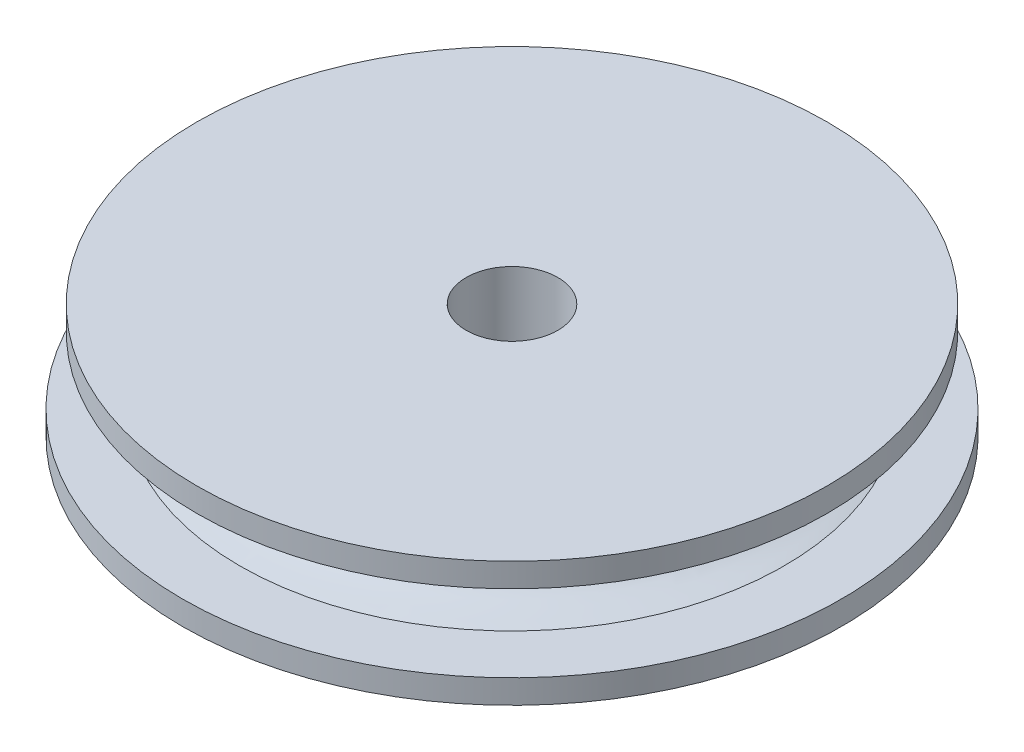
from build123d import *

# Parameters (mm, degrees)
SKETCH1_R           = 9.5
BOSS_EXTRUDE1_DEPTH = 4
SKETCH3_R           = 1.6
CUT_EXTRUDE1_DEPTH  = 15.017845904
SKETCH4_R           = 11
SKETCH4_R_2         = 1.6
EXTENSION_TOP_DEPTH = 0.832825
BOSS_EXTRUDE4_START = -0.832825
SKETCH5_R           = 11.5
SKETCH5_R_2         = 1.6
BOSS_EXTRUDE4_DEPTH = 0.832825


with BuildPart() as part:
    # Sketch1 → Boss-Extrude1 (new body)
    with BuildSketch(Plane(origin=(0, 0, 0), x_dir=(1, 0, 0), z_dir=(0, 1, 0))):
        with Locations(Location((0, 0, 0), (0, 0, 270))):
            Circle(SKETCH1_R)
    extrude(amount=BOSS_EXTRUDE1_DEPTH)

    # Sketch2 → Cut-Revolve3 (revolve, cut)
    with BuildSketch(Plane.XY, mode=Mode.PRIVATE) as cut_revolve3_sk:
        with BuildLine():
            Line((-9.5, 3.167174781), (-9.5, 0.832825219))
            add(Edge.make_bspline(
                [(-9.5, 0.832825219), (-8.911003923, 1.01519245), (-7.940181452, 1.15692307), (-8, 2)],
                knots=[0, 0, 0, 0, 1, 1, 1, 1], degree=3))
            add(Edge.make_bspline(
                [(-9.5, 3.167174781), (-8.911003923, 2.98480755), (-7.940181452, 2.84307693), (-8, 2)],
                knots=[0, 0, 0, 0, 1, 1, 1, 1], degree=3))
        make_face()
    revolve(cut_revolve3_sk.sketch.rotate(Axis((0, 4.2, 0), (0, -1, 0)), 270), axis=Axis((0, 4.2, 0), (0, -1, 0)), mode=Mode.SUBTRACT)

    # Sketch3 → Cut-Extrude1 (cut, through all)
    with BuildSketch(Plane(origin=(0, 4, 0), x_dir=(1, 0, 0), z_dir=(0, 1, 0))):
        with Locations(Location((0, 0, 0), (0, 0, 270))):
            Circle(SKETCH3_R)
    extrude(amount=-CUT_EXTRUDE1_DEPTH, mode=Mode.SUBTRACT)

    # Sketch4 → Extension top (add)
    with BuildSketch(Plane(origin=(0, 4, 0), x_dir=(1, 0, 0), z_dir=(0, 1, 0))):
        with Locations(Location((0, 0, 0), (0, 0, 270))):
            Circle(SKETCH4_R)
        with Locations(Location((0, 0, 0), (0, 0, 270))):
            Circle(SKETCH4_R_2, mode=Mode.SUBTRACT)
    extrude(amount=-EXTENSION_TOP_DEPTH)

    # Sketch5 → Boss-Extrude4 (add)
    with BuildSketch(Plane.XZ.offset(BOSS_EXTRUDE4_START)):
        with Locations(Location((0, 0, 0), (0, 0, 270))):
            Circle(SKETCH5_R)
        with Locations(Location((0, 0, 0), (0, 0, 90))):
            Circle(SKETCH5_R_2, mode=Mode.SUBTRACT)
    extrude(amount=BOSS_EXTRUDE4_DEPTH)


solid = part.part
